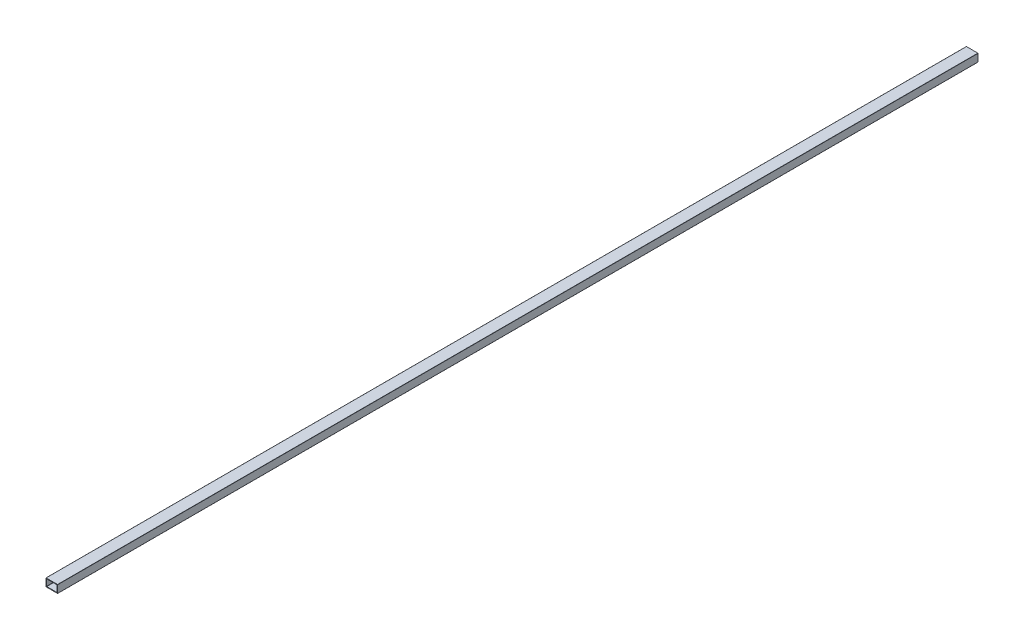
from build123d import *

# Parameters (mm, degrees)
CROQUIS1_W              = 76.2
CROQUIS1_H              = 50.8
CROQUIS1_W_2            = 68.6
CROQUIS1_H_2            = 43.2
SALIENTE_EXTRUIR1_DEPTH = 6000
REDONDEO1_R             = 1


with BuildPart() as part:
    # Croquis1 → Saliente-Extruir1 (new body)
    with BuildSketch(Plane.XY):
        Rectangle(CROQUIS1_W, CROQUIS1_H)
        Rectangle(CROQUIS1_W_2, CROQUIS1_H_2, mode=Mode.SUBTRACT)
    extrude(amount=-SALIENTE_EXTRUIR1_DEPTH)

    # Redondeo1
    redondeo1_edges = [part.edges().sort_by_distance(p)[0] for p in [
        (34.3, -21.6, -3000),
        (-34.3, -21.6, -3000),
        (-34.3, 21.6, -3000),
        (34.3, 21.6, -3000),
        (38.1, -25.4, -3000),
        (-38.1, -25.4, -3000),
        (-38.1, 25.4, -3000),
        (38.1, 25.4, -3000),
    ]]
    fillet(redondeo1_edges, radius=REDONDEO1_R)


solid = part.part
